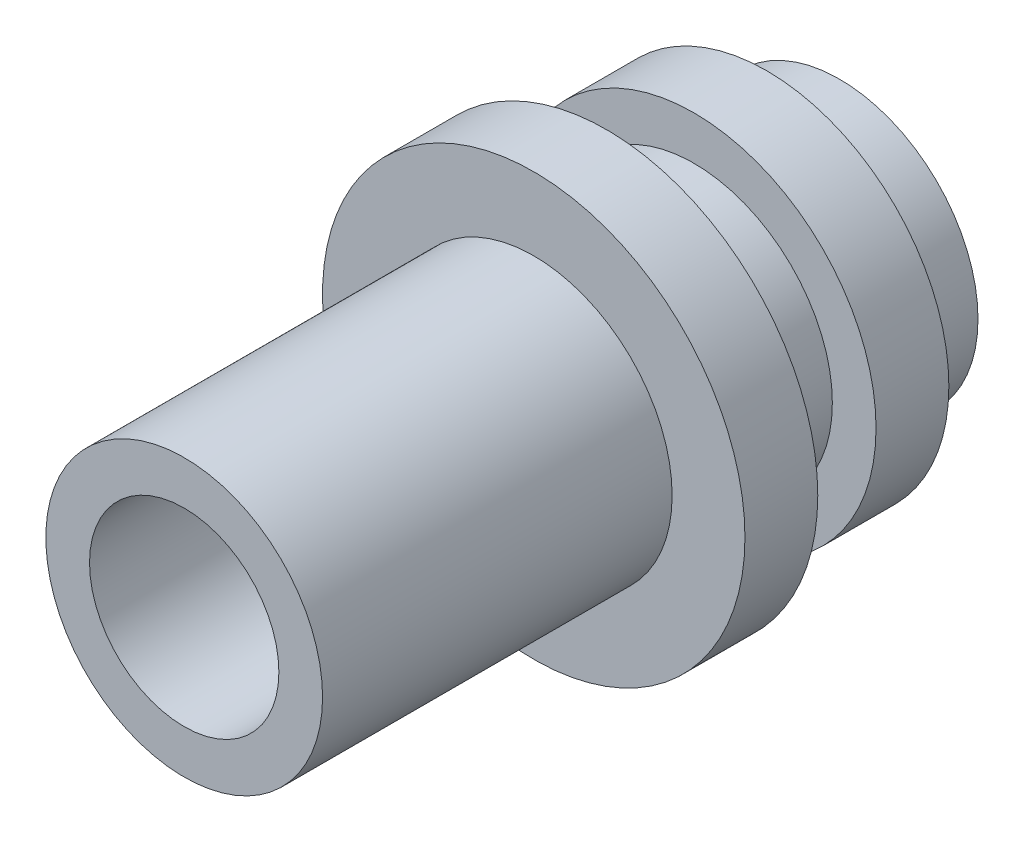
from build123d import *

# Parameters (mm, degrees)
SKETCH1_R         = 7.25
FLANGE_DEPTH      = 2.5
BARREL_START      = 2.5
SKETCH2_R         = 4.75
BARREL_DEPTH      = 12
REAR_THREAD_START = -8
SKETCH3_R         = 4.75
REAR_THREAD_DEPTH = 8
REAR_NUT_START    = -5.5
SKETCH4_R         = 6.25
REAR_NUT_DEPTH    = 2.5
SOCKET_BORE_START = 14.5
SKETCH5_R         = 3.25
SOCKET_BORE_DEPTH = 8


with BuildPart() as part:
    # Sketch1 → Flange (new body)
    with BuildSketch(Plane.XY):
        Circle(SKETCH1_R)
    extrude(amount=FLANGE_DEPTH)

    # Sketch2 → Barrel (add)
    with BuildSketch(Plane.XY.offset(BARREL_START)):
        Circle(SKETCH2_R)
    extrude(amount=BARREL_DEPTH)

    # Sketch3 → Rear_Thread (add)
    with BuildSketch(Plane.XY.offset(REAR_THREAD_START)):
        Circle(SKETCH3_R)
    extrude(amount=REAR_THREAD_DEPTH)

    # Sketch4 → Rear_Nut (add)
    with BuildSketch(Plane.XY.offset(REAR_NUT_START)):
        Circle(SKETCH4_R)
    extrude(amount=REAR_NUT_DEPTH)

    # Sketch5 → Socket_Bore (cut)
    with BuildSketch(Plane.XY.offset(SOCKET_BORE_START)):
        Circle(SKETCH5_R)
    extrude(amount=-SOCKET_BORE_DEPTH, mode=Mode.SUBTRACT)


solid = part.part
